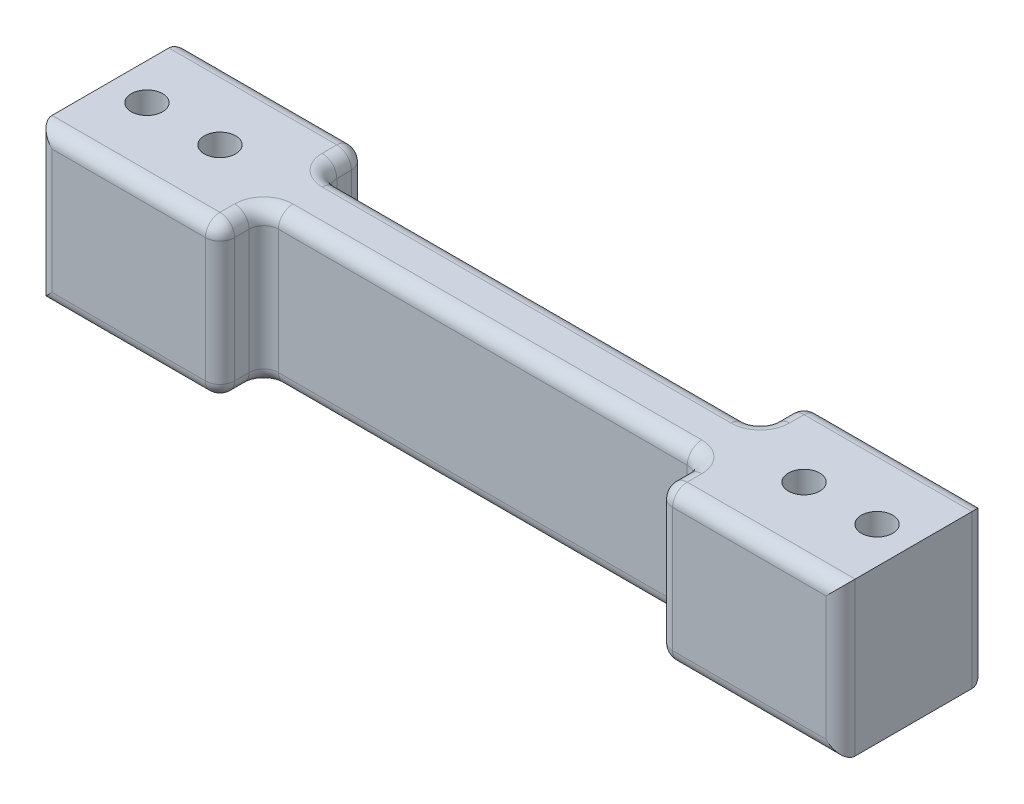
from build123d import *

# Parameters (mm, degrees)
SKETCH_1_W          = 110
SKETCH_1_H          = 21
EXTRUDE_1_DEPTH     = 20
CUT_EXTRUDE_1_REACH = 115.759
SKETCH_2_R          = 2.15
CUT_EXTRUDE_2_REACH = 115.759
SKETCH_3_W          = 60
SKETCH_3_H          = 6
FILLET_2_R          = 2


with BuildPart() as part:
    # 草图1 → 凸台-拉伸1 (new body)
    with BuildSketch(Plane.XY):
        with Locations((-55, 10.5)):
            Rectangle(SKETCH_1_W, SKETCH_1_H)
    extrude(amount=EXTRUDE_1_DEPTH)

    # 草图2 → 切除-拉伸1 (cut, up to next)
    with BuildSketch(Plane(origin=(0, 21, 0), x_dir=(1, 0, 0), z_dir=(0, 1, 0)), mode=Mode.PRIVATE) as cut_extrude_1_sk1:
        with Locations(Location((-15, -10, 0), (0, 0, 180))):
            Circle(SKETCH_2_R)
    cut_extrude_1_tool1 = extrude(cut_extrude_1_sk1.sketch, amount=-CUT_EXTRUDE_1_REACH, mode=Mode.PRIVATE) & part.part
    # 草图2 → 切除-拉伸1 (cut, up to next)
    with BuildSketch(Plane(origin=(0, 21, 0), x_dir=(1, 0, 0), z_dir=(0, 1, 0)), mode=Mode.PRIVATE) as cut_extrude_1_sk2:
        with Locations(Location((-5, -10, 0), (0, 0, 180))):
            Circle(SKETCH_2_R)
    cut_extrude_1_tool2 = extrude(cut_extrude_1_sk2.sketch, amount=-CUT_EXTRUDE_1_REACH, mode=Mode.PRIVATE) & part.part
    # 草图2 → 切除-拉伸1 (cut, up to next)
    with BuildSketch(Plane(origin=(0, 21, 0), x_dir=(1, 0, 0), z_dir=(0, 1, 0)), mode=Mode.PRIVATE) as cut_extrude_1_sk3:
        with Locations(Location((-105, -10, 0), (0, 0, 180))):
            Circle(SKETCH_2_R)
    cut_extrude_1_tool3 = extrude(cut_extrude_1_sk3.sketch, amount=-CUT_EXTRUDE_1_REACH, mode=Mode.PRIVATE) & part.part
    # 草图2 → 切除-拉伸1 (cut, up to next)
    with BuildSketch(Plane(origin=(0, 21, 0), x_dir=(1, 0, 0), z_dir=(0, 1, 0)), mode=Mode.PRIVATE) as cut_extrude_1_sk4:
        with Locations(Location((-95, -10, 0), (0, 0, 180))):
            Circle(SKETCH_2_R)
    cut_extrude_1_tool4 = extrude(cut_extrude_1_sk4.sketch, amount=-CUT_EXTRUDE_1_REACH, mode=Mode.PRIVATE) & part.part
    add(cut_extrude_1_tool1.solids().sort_by_distance((-15, 21, 10))[0], mode=Mode.SUBTRACT)
    add(cut_extrude_1_tool2.solids().sort_by_distance((-5, 21, 10))[0], mode=Mode.SUBTRACT)
    add(cut_extrude_1_tool3.solids().sort_by_distance((-105, 21, 10))[0], mode=Mode.SUBTRACT)
    add(cut_extrude_1_tool4.solids().sort_by_distance((-95, 21, 10))[0], mode=Mode.SUBTRACT)

    # 草图3 → 切除-拉伸2 (cut, up to next)
    with BuildSketch(Plane(origin=(0, 21, 0), x_dir=(1, 0, 0), z_dir=(0, 1, 0)), mode=Mode.PRIVATE) as cut_extrude_2_sk1:
        with Locations((-55, -3)):
            Rectangle(SKETCH_3_W, SKETCH_3_H)
    cut_extrude_2_tool1 = extrude(cut_extrude_2_sk1.sketch, amount=-CUT_EXTRUDE_2_REACH, mode=Mode.PRIVATE) & part.part
    # 草图3 → 切除-拉伸2 (cut, up to next)
    with BuildSketch(Plane(origin=(0, 21, 0), x_dir=(1, 0, 0), z_dir=(0, 1, 0)), mode=Mode.PRIVATE) as cut_extrude_2_sk2:
        with Locations((-55, -17)):
            Rectangle(SKETCH_3_W, SKETCH_3_H)
    cut_extrude_2_tool2 = extrude(cut_extrude_2_sk2.sketch, amount=-CUT_EXTRUDE_2_REACH, mode=Mode.PRIVATE) & part.part
    add(cut_extrude_2_tool1.solids().sort_by_distance((-55, 21, 3))[0], mode=Mode.SUBTRACT)
    add(cut_extrude_2_tool2.solids().sort_by_distance((-55, 21, 17))[0], mode=Mode.SUBTRACT)

    # 圆角2
    fillet_2_edges = [part.edges().sort_by_distance(p)[0] for p in [
        (-110, 10.5, 20),
        (-97.5, 0, 20),
        (-12.5, 0, 0),
        (-97.5, 21, 0),
        (-97.5, 21, 20),
        (-12.5, 0, 20),
        (-85, 10.5, 6),
        (-85, 10.5, 0),
        (-25, 10.5, 0),
        (-25, 10.5, 6),
        (-85, 21, 3),
        (-55, 21, 6),
        (-25, 21, 3),
        (-55, 0, 6),
        (-85, 0, 3),
        (-25, 0, 3),
        (-25, 10.5, 20),
        (-85, 10.5, 20),
        (-85, 10.5, 14),
        (-25, 10.5, 14),
        (0, 10.5, 20),
        (-97.5, 0, 0),
        (-25, 21, 17),
        (-55, 21, 14),
        (-85, 21, 17),
        (-85, 0, 17),
        (-55, 0, 14),
        (-25, 0, 17),
        (-110, 10.5, 0),
        (-12.5, 21, 0),
        (0, 10.5, 0),
        (-12.5, 21, 20),
    ]]
    fillet(fillet_2_edges, radius=FILLET_2_R)


solid = part.part
